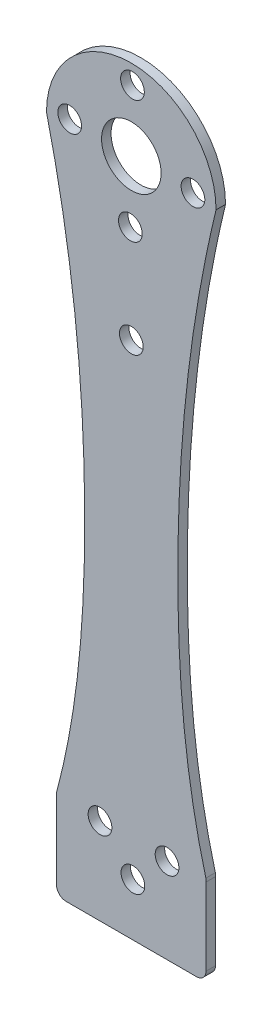
from build123d import *

# Parameters (mm, degrees)
BOSS_EXTRUDE1_DEPTH = 1.27
SKETCH3_R           = 1.5875
SKETCH3_R_2         = 3.9878
CUT_EXTRUDE1_DEPTH  = 97.298395578


with BuildPart() as part:
    # Sketch1 → Boss-Extrude1 (new body)
    with BuildSketch(Plane.XY):
        with BuildLine():
            Line((10.0076, 5.622584698), (10.0076, -4.7117))
            ThreePointArc((10.0076, -4.7117), (9.635625612, -5.609725612), (8.7376, -5.9817))
            Line((8.7376, -5.9817), (-8.7376, -5.9817))
            ThreePointArc((-8.7376, -5.9817), (-9.635625612, -5.609725612), (-10.0076, -4.7117))
            Line((-10.0076, -4.7117), (-10.0076, 5.622584698))
            ThreePointArc((-10.0076, 5.622584698), (-10.003391038, 5.85374719), (-9.990769733, 6.084603239))
            add(Edge.make_bspline(
                [(-9.990769733, 6.084603239), (-7.167817584, 16.591535459), (-5.051519119, 42.938826991), (-7.717998868, 69.224459282), (-11.3538, 84.2645)],
                knots=[0, 0, 0, 0, 0.412468481, 1, 1, 1, 1], degree=3))
            ThreePointArc((-11.3538, 84.2645), (0, 95.6183), (11.3538, 84.2645))
            add(Edge.make_bspline(
                [(9.990769733, 6.084603239), (7.167817584, 16.591535459), (5.051519119, 42.938826991), (7.717998868, 69.224459282), (11.3538, 84.2645)],
                knots=[0, 0, 0, 0, 0.412468481, 1, 1, 1, 1], degree=3))
            ThreePointArc((9.990769733, 6.084603239), (10.003391038, 5.85374719), (10.0076, 5.622584698))
        make_face()
    extrude(amount=BOSS_EXTRUDE1_DEPTH)

    # Sketch3 → Cut-Extrude1 (cut, through all)
    with BuildSketch(Plane.XY.offset(1.27)):
        with Locations((0.009537188, 63.488174324)):
            Circle(SKETCH3_R)
        with Locations((-4.18787141, 5.623885886)):
            Circle(SKETCH3_R)
        with Locations((0.009537188, 84.824174324)):
            Circle(SKETCH3_R_2)
        with Locations((4.790889658, 5.460027166)):
            Circle(SKETCH3_R)
        with Locations((0.219579764, 1.052575992)):
            Circle(SKETCH3_R)
        with Locations((8.263377785, 84.685825499)):
            Circle(SKETCH3_R)
        with Locations((-0.117124746, 76.531516693)):
            Circle(SKETCH3_R)
        with Locations((-8.243855334, 84.987075758)):
            Circle(SKETCH3_R)
        with Locations((0.160867255, 93.116418474)):
            Circle(SKETCH3_R)
    extrude(amount=-CUT_EXTRUDE1_DEPTH, mode=Mode.SUBTRACT)


solid = part.part
